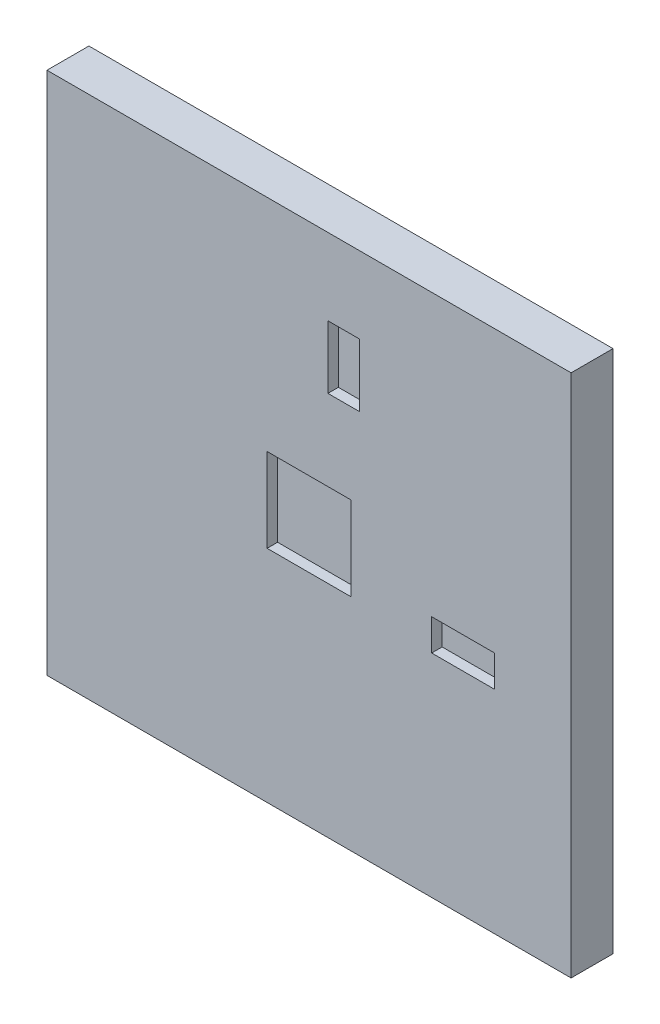
from build123d import *

# Parameters (mm, degrees)
SKETCH1_W           = 250
SKETCH1_H           = 250
BOSS_EXTRUDE1_DEPTH = 20
SKETCH2_W           = 15
SKETCH2_H           = 30
SKETCH2_W_2         = 30
SKETCH2_H_2         = 15
SKETCH2_W_3         = 40
SKETCH2_H_3         = 40
CUT_EXTRUDE1_DEPTH  = 5


with BuildPart() as part:
    # Sketch1 → Boss-Extrude1 (new body)
    with BuildSketch(Plane.XY):
        with Locations((22.048407602, -70.903707865)):
            Rectangle(SKETCH1_W, SKETCH1_H)
    extrude(amount=BOSS_EXTRUDE1_DEPTH)

    # Sketch2 → Cut-Extrude1 (cut)
    with BuildSketch(Plane.XY.offset(20)):
        with Locations((38.548407602, 2.596292135)):
            Rectangle(SKETCH2_W, SKETCH2_H)
        with Locations((95.548407602, -87.403707865)):
            Rectangle(SKETCH2_W_2, SKETCH2_H_2)
        with Locations((22.048407602, -70.903707865)):
            Rectangle(SKETCH2_W_3, SKETCH2_H_3)
    extrude(amount=-CUT_EXTRUDE1_DEPTH, mode=Mode.SUBTRACT)


solid = part.part
